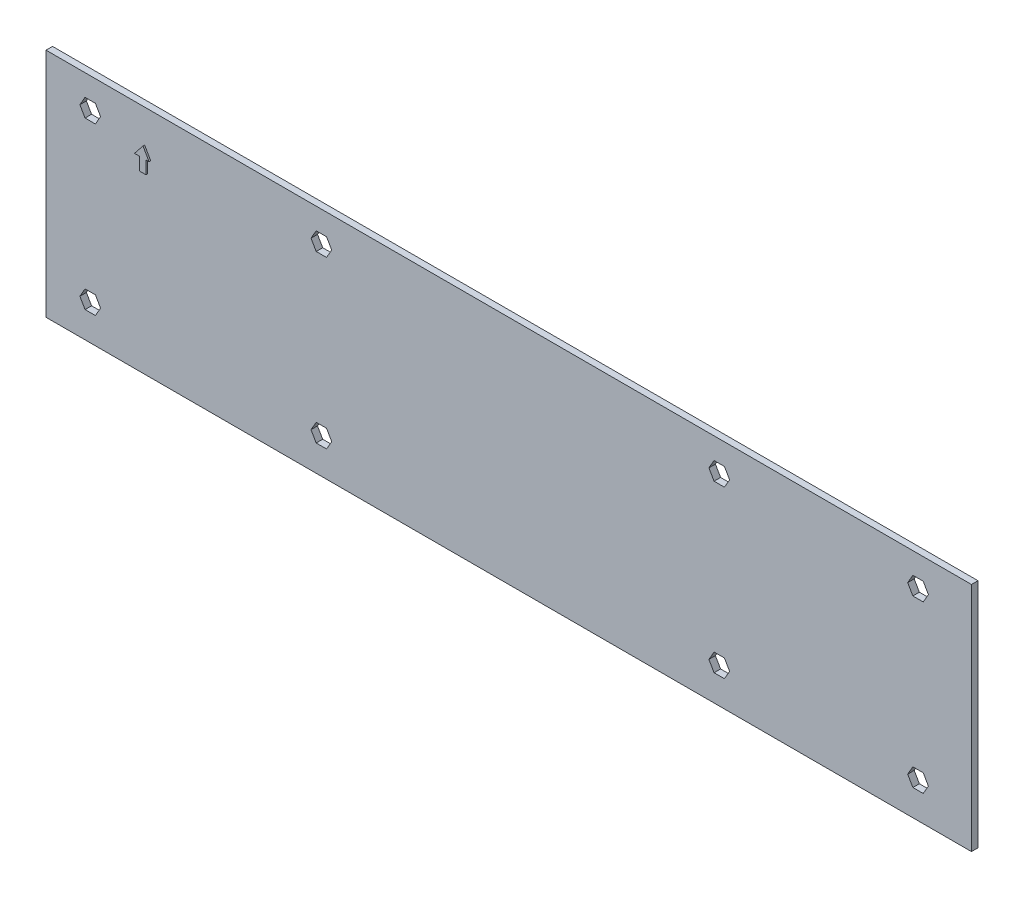
from build123d import *

# Parameters (mm, degrees)
SKETCH1_W           = 284
SKETCH1_H           = 71
BOSS_EXTRUDE1_DEPTH = 2
BOSS_EXTRUDE2_DEPTH = 0.5


with BuildPart() as part:
    # Sketch1 → Boss-Extrude1 (new body)
    with BuildSketch(Plane.XY):
        with Locations((-0.375320298, 122.74793824)):
            Rectangle(SKETCH1_W, SKETCH1_H)
        Polygon((122.049253222, 148.94793824), (123.636966462, 146.19793824), (126.812392942, 146.19793824), (128.400106183, 148.94793824), (126.812392942, 151.69793824), (123.636966462, 151.69793824), align=None, mode=Mode.SUBTRACT)
        Polygon((122.049253222, 98.04793824), (123.636966462, 95.29793824), (126.812392942, 95.29793824), (128.400106183, 98.04793824), (126.812392942, 100.79793824), (123.636966462, 100.79793824), align=None, mode=Mode.SUBTRACT)
        Polygon((-131.980746778, 98.04793824), (-130.393033538, 95.29793824), (-127.217607058, 95.29793824), (-125.629893817, 98.04793824), (-127.217607058, 100.79793824), (-130.393033538, 100.79793824), align=None, mode=Mode.SUBTRACT)
        Polygon((-125.629893817, 148.94793824), (-127.217607058, 151.69793824), (-130.393033538, 151.69793824), (-131.980746778, 148.94793824), (-130.393033538, 146.19793824), (-127.217607058, 146.19793824), align=None, mode=Mode.SUBTRACT)
        Polygon((-61.050746778, 98.04793824), (-59.463033538, 95.29793824), (-56.287607058, 95.29793824), (-54.699893817, 98.04793824), (-56.287607058, 100.79793824), (-59.463033538, 100.79793824), align=None, mode=Mode.SUBTRACT)
        Polygon((-61.050746778, 148.94793824), (-59.463033538, 146.19793824), (-56.287607058, 146.19793824), (-54.699893817, 148.94793824), (-56.287607058, 151.69793824), (-59.463033538, 151.69793824), align=None, mode=Mode.SUBTRACT)
        Polygon((61.049253222, 148.94793824), (62.636966462, 146.19793824), (65.812392942, 146.19793824), (67.400106183, 148.94793824), (65.812392942, 151.69793824), (62.636966462, 151.69793824), align=None, mode=Mode.SUBTRACT)
        Polygon((61.049253222, 98.04793824), (62.636966462, 95.29793824), (65.812392942, 95.29793824), (67.400106183, 98.04793824), (65.812392942, 100.79793824), (62.636966462, 100.79793824), align=None, mode=Mode.SUBTRACT)
    extrude(amount=BOSS_EXTRUDE1_DEPTH)

    # Sketch2 → Boss-Extrude2 (add)
    with BuildSketch(Plane.XY.offset(2)):
        Polygon((-113.14842838, 140.954026683), (-113.14842838, 144.897894949), (-114.711093164, 144.897894949), (-112.106651856, 148.172049737), (-110.246336636, 144.897894949), (-111.176494246, 144.897894949), (-111.176494246, 140.954026683), align=None)
    extrude(amount=BOSS_EXTRUDE2_DEPTH)


solid = part.part
